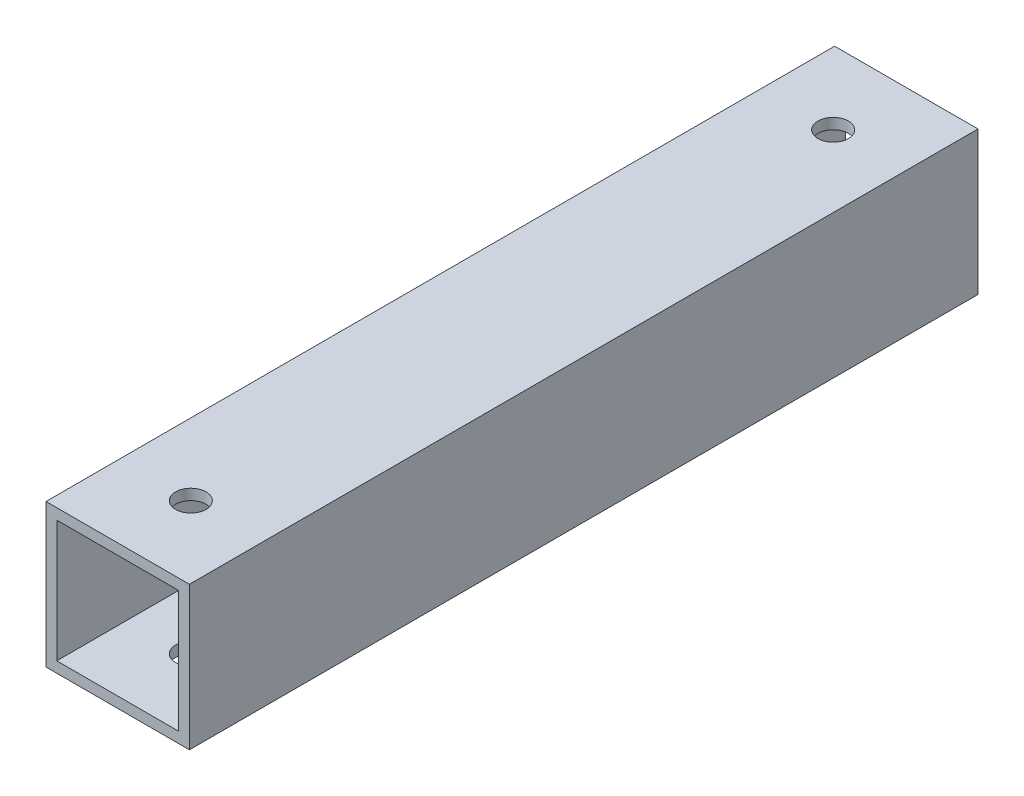
from build123d import *

# Parameters (mm, degrees)
SKETCH1_W           = 20
SKETCH1_H           = 20
SKETCH1_W_2         = 17
SKETCH1_H_2         = 17
BOSS_EXTRUDE1_DEPTH = 110
SKETCH2_R           = 2.125
CUT_EXTRUDE1_DEPTH  = 113.249721603


with BuildPart() as part:
    # Sketch1 → Boss-Extrude1 (new body)
    with BuildSketch(Plane.XY):
        Rectangle(SKETCH1_W, SKETCH1_H)
        Rectangle(SKETCH1_W_2, SKETCH1_H_2, mode=Mode.SUBTRACT)
    extrude(amount=-BOSS_EXTRUDE1_DEPTH)

    # Sketch2 → Cut-Extrude1 (cut, through all)
    with BuildSketch(Plane(origin=(0, 10, 0), x_dir=(1, 0, 0), z_dir=(0, 1, 0))):
        with Locations(Location((0, 10.2, 0), (0, 0, 270))):
            Circle(SKETCH2_R)
        with Locations(Location((0, 99.8, 0), (0, 0, 90))):
            Circle(SKETCH2_R)
    extrude(amount=-CUT_EXTRUDE1_DEPTH, mode=Mode.SUBTRACT)


solid = part.part
